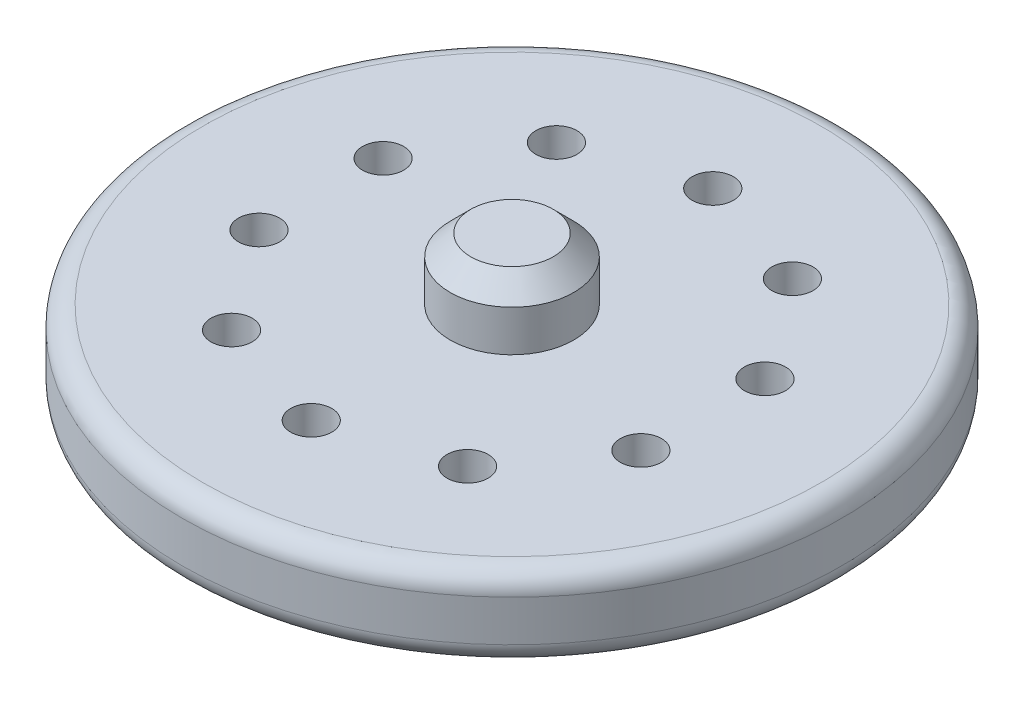
from build123d import *

# Parameters (mm, degrees)
SKETCH1_R           = 80
BOSS_EXTRUDE1_DEPTH = 20
SKETCH3_R           = 15
BOSS_EXTRUDE2_DEPTH = 15
CHAMFER1_SIZE       = 5
FILLET2_R           = 5
FILLET3_R           = 5
SKETCH4_R           = 5
CUT_EXTRUDE2_DEPTH  = 20


with BuildPart() as part:
    # Sketch1 → Boss-Extrude1 (new body)
    with BuildSketch(Plane(origin=(0, 0, 0), x_dir=(1, 0, 0), z_dir=(0, 1, 0))):
        with Locations(Location((-29.715512057, 28.347034528, 0), (0, 0, 270))):
            Circle(SKETCH1_R)
    extrude(amount=BOSS_EXTRUDE1_DEPTH)

    # Sketch3 → Boss-Extrude2 (add)
    with BuildSketch(Plane(origin=(0, 20, 0), x_dir=(1, 0, 0), z_dir=(0, 1, 0))):
        with Locations(Location((-29.715512057, 28.347034528, 0), (0, 0, 270))):
            Circle(SKETCH3_R)
    extrude(amount=BOSS_EXTRUDE2_DEPTH)

    # Chamfer1
    chamfer1_edges = [part.edges().sort_by_distance(p)[0] for p in [
        (-29.715512057, 35, -43.347034528),
    ]]
    chamfer(chamfer1_edges, length=CHAMFER1_SIZE)

    # Fillet2
    fillet2_edges = [part.edges().sort_by_distance(p)[0] for p in [
        (-29.715512057, 20, -108.347034528),
    ]]
    fillet(fillet2_edges, radius=FILLET2_R)

    # Fillet3
    fillet3_edges = [part.edges().sort_by_distance(p)[0] for p in [
        (-29.715512057, 0, -108.347034528),
    ]]
    fillet(fillet3_edges, radius=FILLET3_R)

    # Sketch4 → Cut-Extrude2 (cut)
    with BuildSketch(Plane(origin=(0, 20, 0), x_dir=(1, 0, 0), z_dir=(0, 1, 0))):
        with Locations(Location((-29.715512057, 77.081261822, 0), (0, 0, 270))):
            Circle(SKETCH4_R)
        with Locations(Location((-1.070251971, 67.773852617, 0), (0, 0, 270))):
            Circle(SKETCH4_R)
        with Locations(Location((16.633492378, 43.406738969, 0), (0, 0, 270))):
            Circle(SKETCH4_R)
        with Locations(Location((16.633492378, 13.287330086, 0), (0, 0, 270))):
            Circle(SKETCH4_R)
        with Locations(Location((-1.070251971, -11.079783561, 0), (0, 0, 270))):
            Circle(SKETCH4_R)
        with Locations(Location((-29.715512057, -20.387192767, 0), (0, 0, 270))):
            Circle(SKETCH4_R)
        with Locations(Location((-58.360772142, -11.079783561, 0), (0, 0, 270))):
            Circle(SKETCH4_R)
        with Locations(Location((-76.064516492, 13.287330086, 0), (0, 0, 270))):
            Circle(SKETCH4_R)
        with Locations(Location((-76.064516492, 43.406738969, 0), (0, 0, 270))):
            Circle(SKETCH4_R)
        with Locations(Location((-58.360772142, 67.773852617, 0), (0, 0, 270))):
            Circle(SKETCH4_R)
    extrude(amount=-CUT_EXTRUDE2_DEPTH, mode=Mode.SUBTRACT)


solid = part.part
